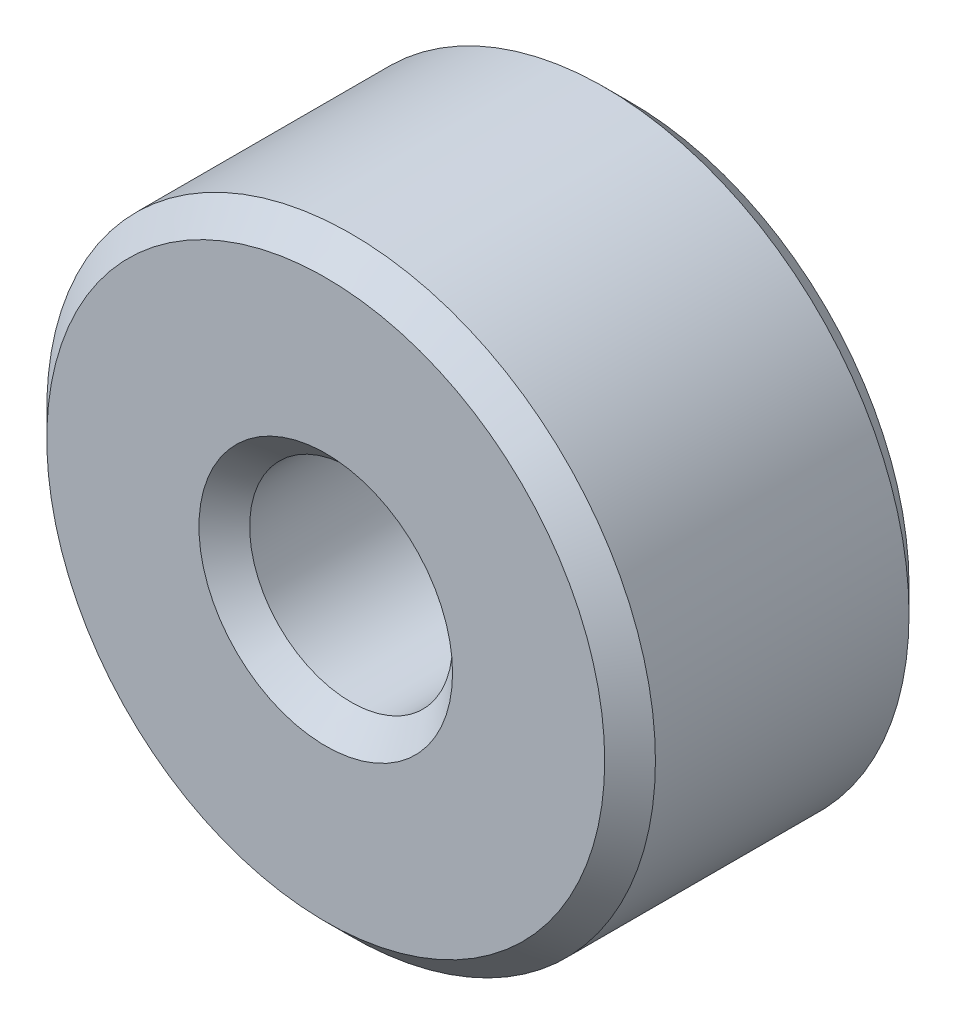
from build123d import *

# Parameters (mm, degrees)
SKETCH1_R           = 3
SKETCH1_R_2         = 1
EXTRUDE_THIN1_DEPTH = 3
CHAMFER1_SIZE       = 0.25
SCALE1_SCALE        = 0.445


with BuildPart() as part:
    # Sketch1 → Extrude-Thin1 (new body)
    with BuildSketch(Plane.XY):
        Circle(SKETCH1_R)
        Circle(SKETCH1_R_2, mode=Mode.SUBTRACT)
    extrude(amount=EXTRUDE_THIN1_DEPTH)

    # Chamfer1
    chamfer1_edges = [part.edges().sort_by_distance(p)[0] for p in [
        (-3, 0, 0),
        (-3, 0, 3),
        (-1, 0, 0),
        (-1, 0, 3),
    ]]
    chamfer(chamfer1_edges, length=CHAMFER1_SIZE)


with BuildPart() as part_1:
    # Scale1: scaled about (0, 0, 0)
    add(part.part.scale(SCALE1_SCALE))


solid = part_1.part
